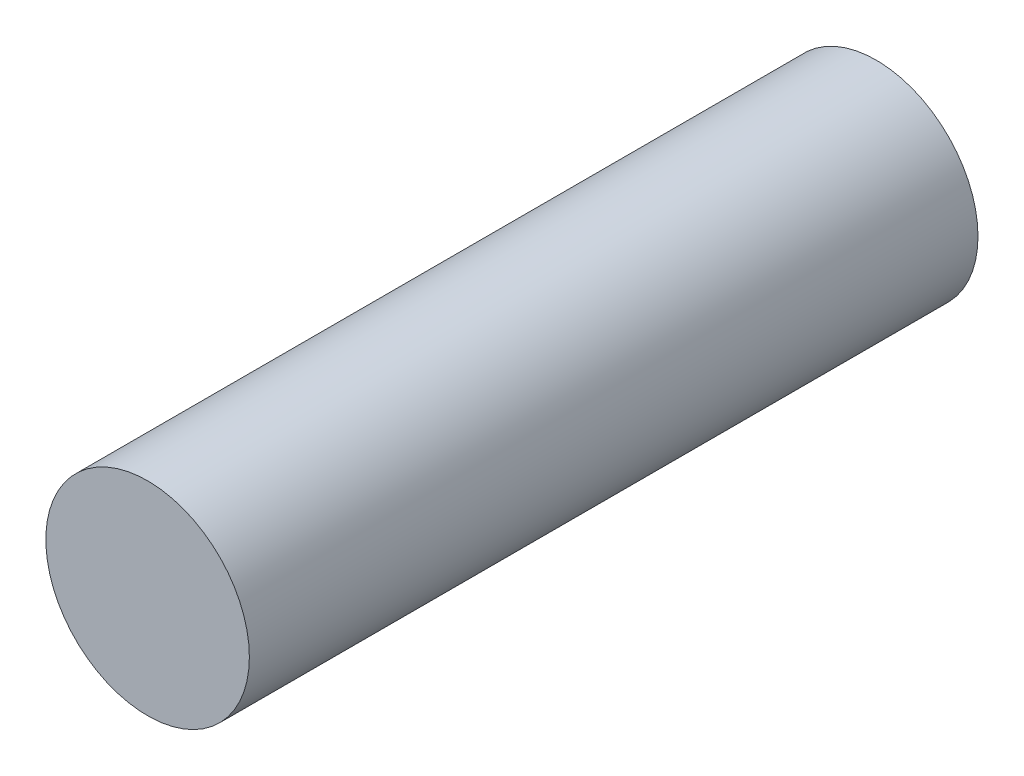
from build123d import *

# Parameters (mm, degrees)
SKETCH1_R  = 9.05
CELL_DEPTH = 64.8


with BuildPart() as part:
    # Sketch1 → Cell (new body)
    with BuildSketch(Plane.XY):
        Circle(SKETCH1_R)
    extrude(amount=CELL_DEPTH)


solid = part.part
